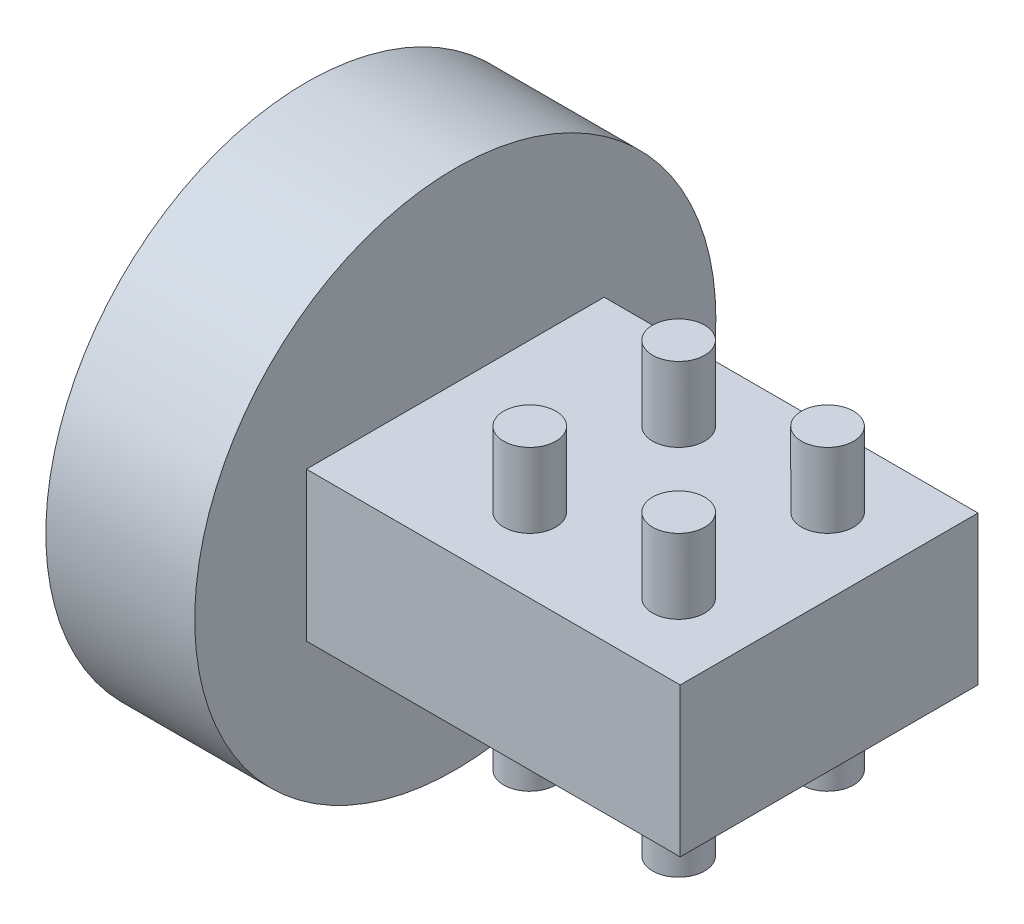
from build123d import *

# Parameters (mm, degrees)
SKETCH1_R                = 35
BOSS_EXTRUDE1_DEPTH      = 20
SKETCH2_R                = 25
CUT_EXTRUDE1_DEPTH       = 10
BOSS_EXTRUDE2_DEPTH      = 10
BOSS_EXTRUDE2_DEPTH_BACK = 10
SKETCH3_W                = 70
SKETCH3_H                = 40
BOSS_EXTRUDE3_DEPTH      = 20
BOSS_EXTRUDE3_DEPTH_BACK = 20
SKETCH5_R                = 3.5
CUT_EXTRUDE2_START       = 27
SKETCH6_R                = 25
CUT_EXTRUDE2_DEPTH       = 27


with BuildPart() as part:
    # Sketch1 → Boss-Extrude1 (new body)
    with BuildSketch(Plane(origin=(0, 0, 0), x_dir=(0, 0, -1), z_dir=(1, 0, 0))):
        Circle(SKETCH1_R)
    extrude(amount=BOSS_EXTRUDE1_DEPTH)

    # Sketch2 → Cut-Extrude1 (cut)
    with BuildSketch(Plane(origin=(0, 0, 0), x_dir=(0, 0, -1), z_dir=(1, 0, 0))):
        Circle(SKETCH2_R)
    extrude(amount=CUT_EXTRUDE1_DEPTH, mode=Mode.SUBTRACT)

    # Sketch3 → Boss-Extrude2 (add, two sides: drawn at the far end of the back side and taken through both)
    with BuildSketch(Plane(origin=(0, 0, 0), x_dir=(1, 0, 0), z_dir=(0, 1, 0)).offset(-BOSS_EXTRUDE2_DEPTH_BACK)):
        with Locations((35.208452682, 0)):
            Rectangle(SKETCH3_W, SKETCH3_H)
    extrude(amount=BOSS_EXTRUDE2_DEPTH + BOSS_EXTRUDE2_DEPTH_BACK)

    # Sketch5 → Boss-Extrude3 (add, two sides: drawn at the far end of the back side and taken through both)
    with BuildSketch(Plane(origin=(0, 0, 0), x_dir=(1, 0, 0), z_dir=(0, 1, 0)).offset(-BOSS_EXTRUDE3_DEPTH_BACK)):
        with Locations((40, -10)):
            Circle(SKETCH5_R)
        with Locations((40, 10)):
            Circle(SKETCH5_R)
        with Locations((60, 10)):
            Circle(SKETCH5_R)
        with Locations((60, -10)):
            Circle(SKETCH5_R)
    extrude(amount=BOSS_EXTRUDE3_DEPTH + BOSS_EXTRUDE3_DEPTH_BACK)

    # Sketch6 → Cut-Extrude2 (cut)
    with BuildSketch(Plane.ZY.offset(-10).offset(CUT_EXTRUDE2_START)):
        Circle(SKETCH6_R)
    extrude(amount=-CUT_EXTRUDE2_DEPTH, mode=Mode.SUBTRACT)


solid = part.part
